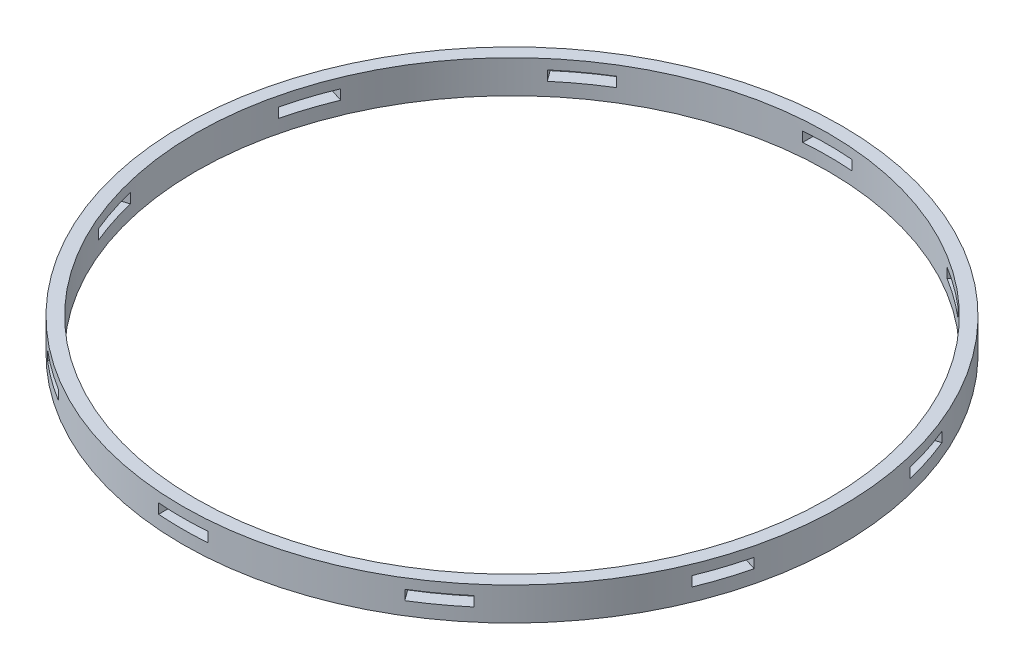
from build123d import *

# Parameters (mm, degrees)
SKETCH1_R           = 100
SKETCH1_R_2         = 96
BOSS_EXTRUDE1_DEPTH = 10
SKETCH2_W           = 15
SKETCH2_H           = 3
CUT_EXTRUDE1_DEPTH  = 142.774468788
CIRPATTERN1_COUNT   = 10


with BuildPart() as part:
    # Sketch1 → Boss-Extrude1 (new body)
    with BuildSketch(Plane(origin=(0, 0, 0), x_dir=(1, 0, 0), z_dir=(0, 1, 0))):
        Circle(SKETCH1_R)
        Circle(SKETCH1_R_2, mode=Mode.SUBTRACT)
    extrude(amount=BOSS_EXTRUDE1_DEPTH)

    # Sketch2 → Cut-Extrude1 (cut, through all)
    with BuildSketch(Plane.XY):
        with Locations((0, 5.5)):
            Rectangle(SKETCH2_W, SKETCH2_H)
    cut_extrude1 = extrude(amount=-CUT_EXTRUDE1_DEPTH, mode=Mode.SUBTRACT)

    # CirPattern1: Cut-Extrude1 ×10 about axis
    cirpattern1_axis = Axis((0, 10, 0), (0, -1, 0))
    for i in range(1, CIRPATTERN1_COUNT):
        add(cut_extrude1.rotate(cirpattern1_axis, i * 360 / CIRPATTERN1_COUNT), mode=Mode.SUBTRACT)


solid = part.part
